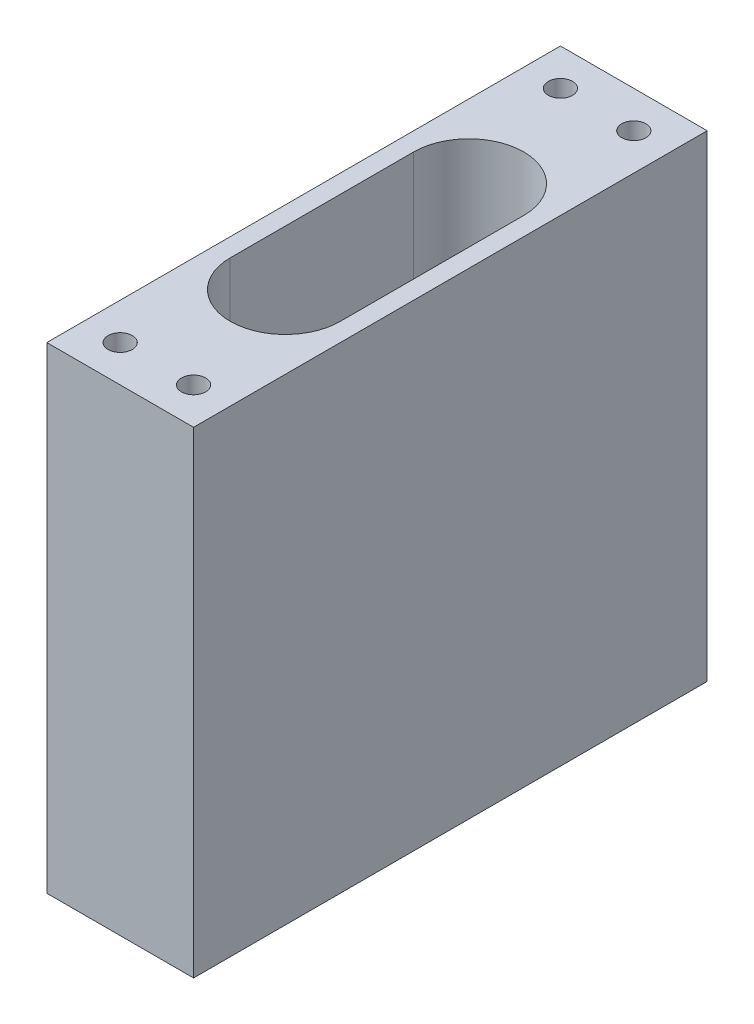
from build123d import *

# Parameters (mm, degrees)
SKETCH1_W             = 20
SKETCH1_H             = 70
BOSS_EXTRUDE1_DEPTH   = 32.5
CUT_EXTRUDE1_DEPTH    = 75.498322129
SKETCH3_R             = 1.5
CUT_EXTRUDE2_DEPTH    = 100
M4_TAPPED_HOLE1_D     = 3.3
M4_TAPPED_HOLE1_DEPTH = 102.1
M4_TAPPED_HOLE1_TIP   = 0.991420021


with BuildPart() as part:
    # Sketch1 → Boss-Extrude1 (new, symmetric)
    with BuildSketch(Plane(origin=(0, 0, 0), x_dir=(1, 0, 0), z_dir=(0, 1, 0))):
        Rectangle(SKETCH1_W, SKETCH1_H)
    extrude(amount=BOSS_EXTRUDE1_DEPTH, both=True)

    # Sketch2 → Cut-Extrude1 (cut, through all)
    with BuildSketch(Plane.XZ.offset(32.5)):
        with BuildLine():
            Line((-7.5, -12.5), (-7.5, 12.5))
            ThreePointArc((-7.5, 12.5), (0, 20), (7.5, 12.5))
            Line((7.5, 12.5), (7.5, -12.5))
            ThreePointArc((7.5, -12.5), (0, -20), (-7.5, -12.5))
        make_face()
    extrude(amount=-CUT_EXTRUDE1_DEPTH, mode=Mode.SUBTRACT)

    # Sketch3 → Cut-Extrude2 (cut)
    with BuildSketch(Plane.XZ.offset(32.5)):
        with Locations(Location((5, 30, 0), (0, 0, 270))):
            Circle(SKETCH3_R)
        with Locations(Location((-5, 30, 0), (0, 0, 90))):
            Circle(SKETCH3_R)
        with Locations(Location((5, -30, 0), (0, 0, 90))):
            Circle(SKETCH3_R)
        with Locations(Location((-5, -30, 0), (0, 0, 270))):
            Circle(SKETCH3_R)
    extrude(amount=-CUT_EXTRUDE2_DEPTH, mode=Mode.SUBTRACT)

    # M4 Tapped Hole1
    with Locations(Plane(origin=(-5, 32.5, 30), x_dir=(0, 0, 1), z_dir=(0, 1, 0))):
        with Locations((0, 0), (0, 10), (-60, 10), (-60, 0)):
            Hole(M4_TAPPED_HOLE1_D / 2, depth=M4_TAPPED_HOLE1_DEPTH)
            with Locations((0, 0, -(M4_TAPPED_HOLE1_DEPTH + M4_TAPPED_HOLE1_TIP / 2))):  # 118° drill point
                Cone(0, M4_TAPPED_HOLE1_D / 2, M4_TAPPED_HOLE1_TIP, mode=Mode.SUBTRACT)


solid = part.part
